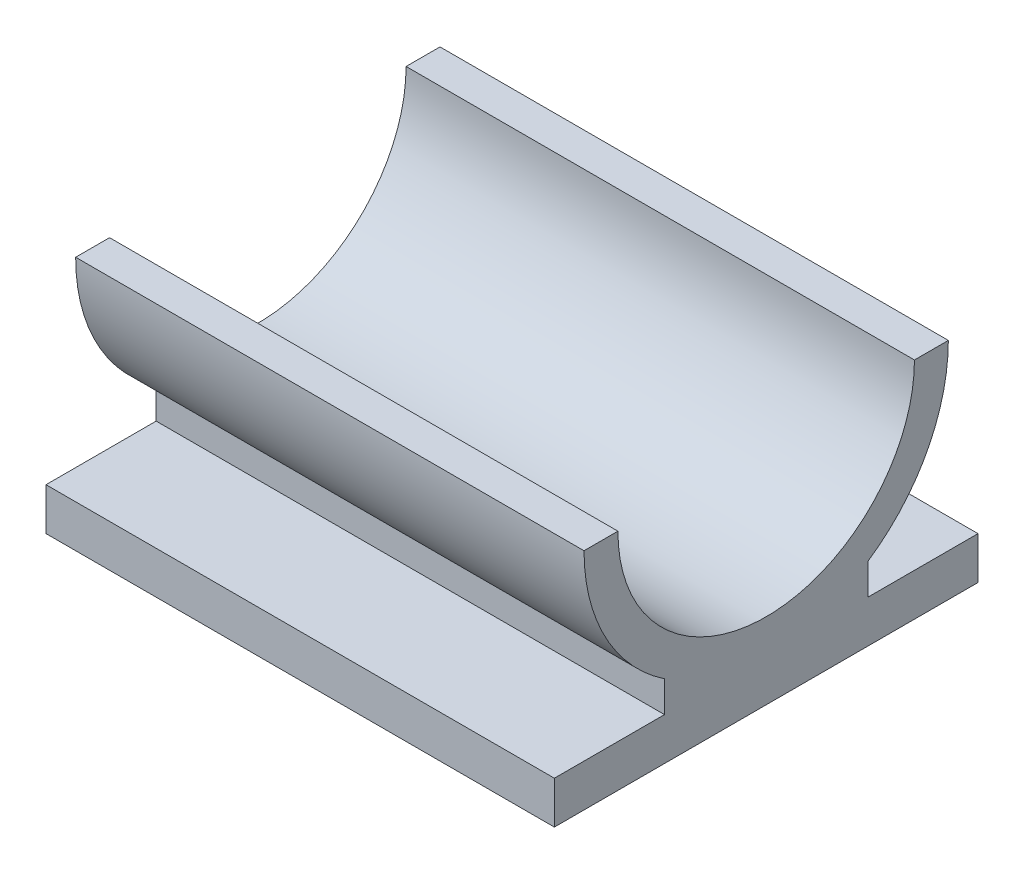
from build123d import *

# Parameters (mm, degrees)
SKETCH1_W           = 76.2
SKETCH1_H           = 63.5
BOSS_EXTRUDE1_DEPTH = 6.35
BOSS_EXTRUDE2_DEPTH = 76.2
SKETCH3_W           = 30.48
SKETCH3_H           = 4.826
BOSS_EXTRUDE3_DEPTH = 76.2


with BuildPart() as part:
    # Sketch1 → Boss-Extrude1 (new body)
    with BuildSketch(Plane(origin=(0, 0, 0), x_dir=(1, 0, 0), z_dir=(0, 1, 0))):
        Rectangle(SKETCH1_W, SKETCH1_H)
    extrude(amount=BOSS_EXTRUDE1_DEPTH)



with BuildPart() as body_2:
    # Sketch2 → Boss-Extrude2 (new body)
    with BuildSketch(Plane(origin=(38.1, 0, 0), x_dir=(0, 0, -1), z_dir=(1, 0, 0))):
        with BuildLine():
            Line((-27.305, 33.655), (-22.225, 33.655))
            ThreePointArc((-22.225, 33.655), (0, 11.43), (22.225, 33.655))
            Line((22.225, 33.655), (27.305, 33.655))
            ThreePointArc((27.305, 33.655), (0, 6.35), (-27.305, 33.655))
        make_face()
    extrude(amount=-BOSS_EXTRUDE2_DEPTH)


with BuildPart() as part_1:
    add(part.part)

    add(body_2.part)  # Boss-Extrude3 merges body 2
    # Sketch3 → Boss-Extrude3 (add)
    with BuildSketch(Plane(origin=(38.1, 0, 0), x_dir=(0, 0, -1), z_dir=(1, 0, 0))):
        with Locations((0, 8.763)):
            Rectangle(SKETCH3_W, SKETCH3_H)
    extrude(amount=-BOSS_EXTRUDE3_DEPTH)


solid = part_1.part
